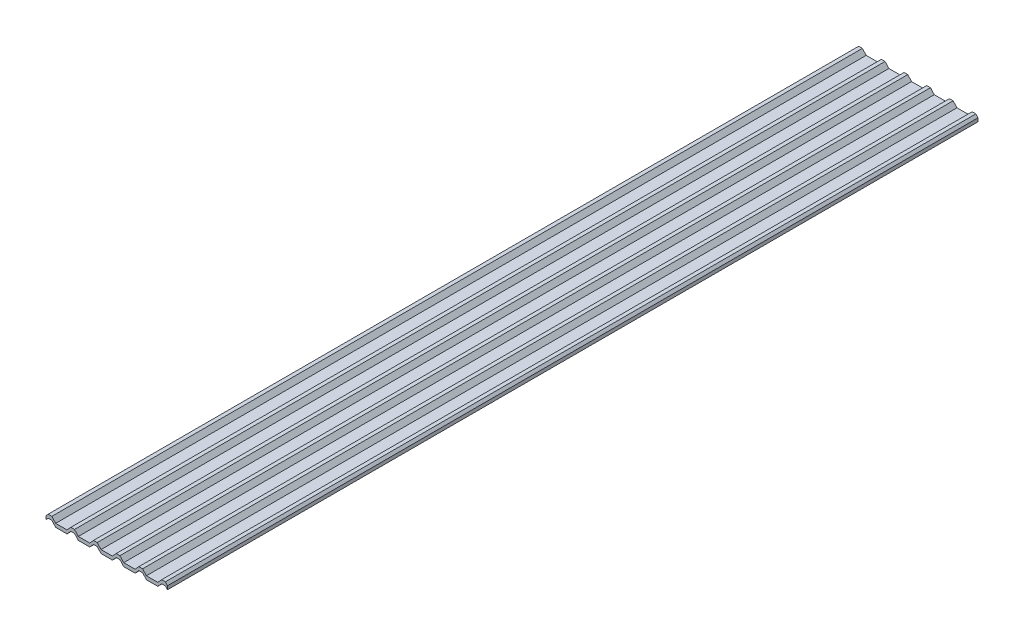
from build123d import *

# Parameters (mm, degrees)
RESSALTO_EXTRUS_O1_DEPTH = 7000


with BuildPart() as part:
    # Esboço1 → Ressalto-extrusão1 (new body)
    with BuildSketch(Plane.XY):
        Polygon((0, 0), (32, 0), (65, -36), (163, -36), (196, 0), (228, 0), (261, -36), (359, -36), (392, 0), (424, 0), (457, -36), (555, -36), (588, 0), (620, 0), (653, -36), (751, -36), (784, 0), (816, 0), (834.566797067, -20), (834.566797067, 10), (816, 30), (784, 30), (751, -6), (653, -6), (620, 30), (588, 30), (555, -6), (457, -6), (424, 30), (392, 30), (359, -6), (261, -6), (228, 30), (196, 30), (163, -6), (65, -6), (32, 30), (0, 30), (-33, -6), (-131, -6), (-164, 30), (-196, 30), (-214.272936105, 10), (-214.272936105, -20), (-196, 0), (-164, 0), (-131, -36), (-33, -36), align=None)
    extrude(amount=RESSALTO_EXTRUS_O1_DEPTH)


solid = part.part
